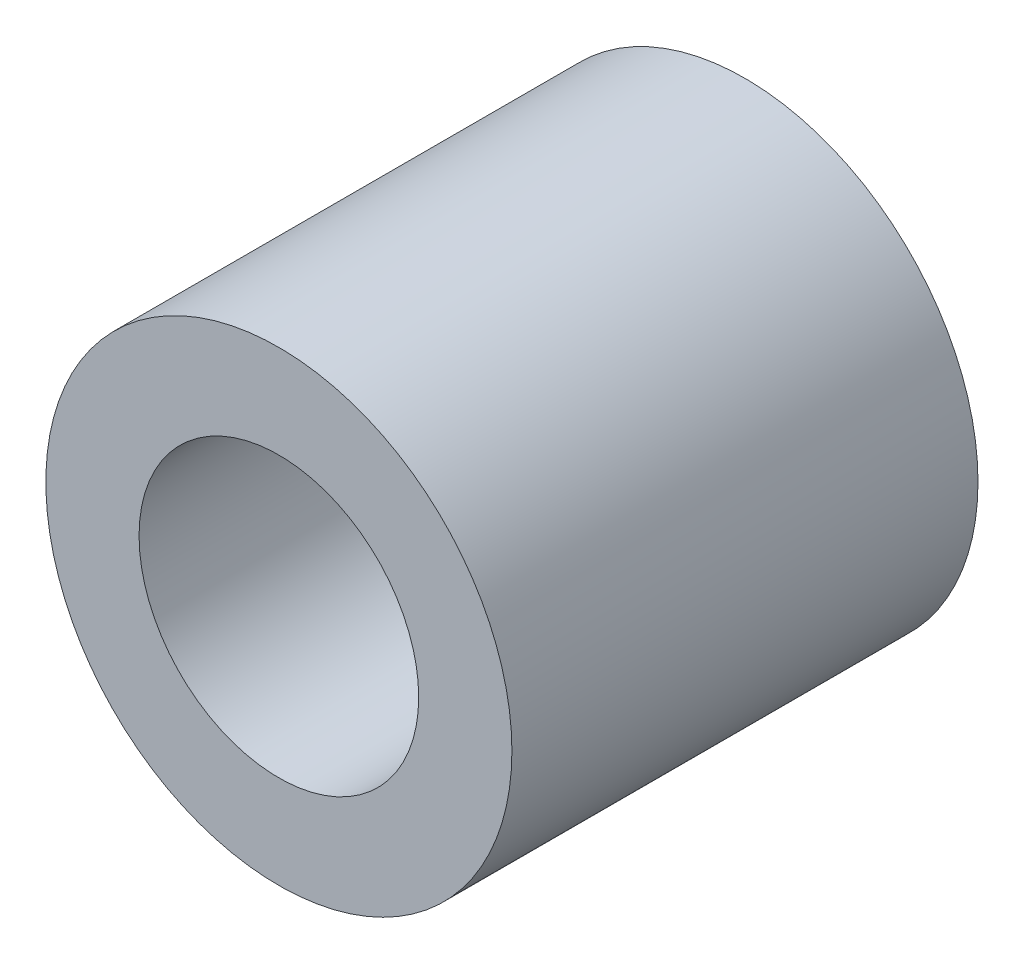
from build123d import *

# Parameters (mm, degrees)
SKETCH1_R      = 5
SKETCH1_R_2    = 3
EXTRUDE1_DEPTH = 10


with BuildPart() as part:
    # Sketch1 → Extrude1 (new body)
    with BuildSketch(Plane.XY):
        Circle(SKETCH1_R)
        Circle(SKETCH1_R_2, mode=Mode.SUBTRACT)
    extrude(amount=EXTRUDE1_DEPTH)


solid = part.part
